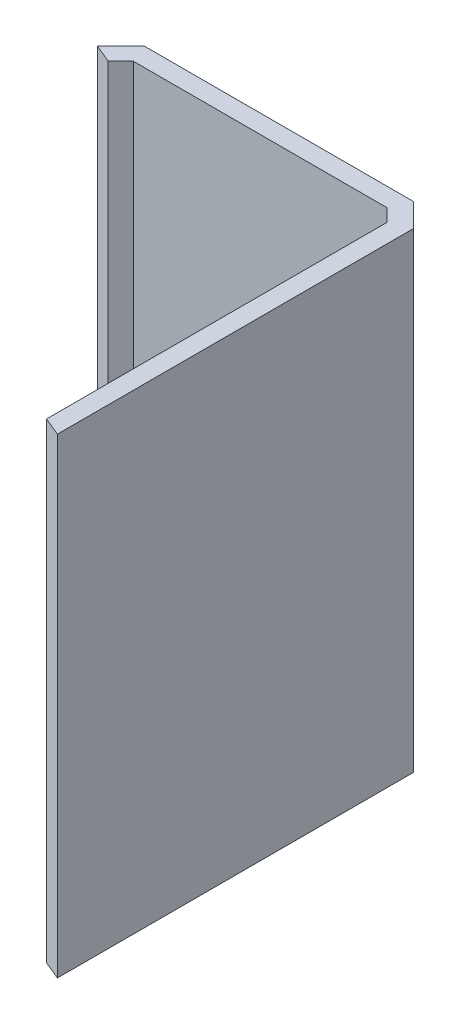
from build123d import *

# Parameters (mm, degrees)
BOSS_EXTRUDE1_DEPTH = 76


with BuildPart() as part:
    # Sketch1 → Boss-Extrude1 (new body)
    with BuildSketch(Plane(origin=(0, 0, 0), x_dir=(1, 0, 0), z_dir=(0, 1, 0))):
        Polygon((-25.008798029, 95.405275845), (-21.232380207, 99.181693667), (22.233842659, 99.181693667), (26.01026048, 95.405275845), (26.01026048, 37.939052979), (23.01026048, 39.181693667), (23.01026048, 94.162635158), (20.991201971, 96.181693667), (-19.98973952, 96.181693667), (-22.008798029, 94.162635158), align=None)
    extrude(amount=BOSS_EXTRUDE1_DEPTH)


solid = part.part
